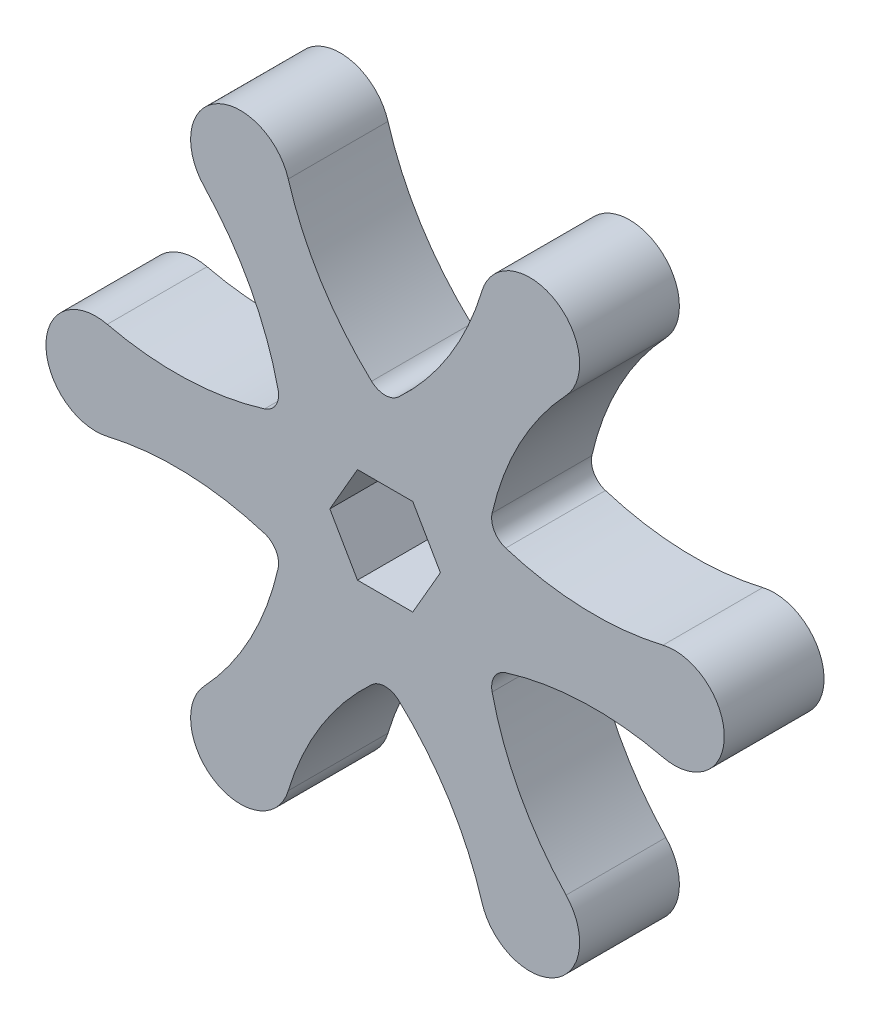
from build123d import *

# Parameters (mm, degrees)
ESQUISSE1_R             = 5
ESQUISSE1_R_2           = 10
BOSS_EXTRU_1_DEPTH      = 10
CONG_1_R                = 2
ENL_V_MAT_EXTRU_1_DEPTH = 1


with BuildPart() as part:
    # Esquisse1 → Boss.-Extru.1 (new body)
    # profile 1 of 19: a face of its own
    with BuildSketch(Plane(origin=(0, 0, 0), x_dir=(0, 1, 0), z_dir=(0, 0, 1))):
        with Locations((0, -29)):
            Circle(ESQUISSE1_R)
    # profile 2 of 19: a face of its own
    with BuildSketch(Plane(origin=(0, 0, 0), x_dir=(0, 1, 0), z_dir=(0, 0, 1))):
        with BuildLine():
            ThreePointArc((5.99413543, -10.382147113), (3.146801004, -10.052477503), (0.281000689, -9.996051151))
            ThreePointArc((0.281000689, -9.996051151), (0, -10), (-0.281000689, -9.996051151))
            ThreePointArc((-0.281000689, -9.996051151), (-3.146801004, -10.052477503), (-5.99413543, -10.382147113))
            ThreePointArc((-5.99413543, -10.382147113), (-4.127637704, -19.033097235), (-4.866476509, -27.852216749))
            ThreePointArc((-4.866476509, -27.852216749), (0, -24), (4.866476509, -27.852216749))
            ThreePointArc((4.866476509, -27.852216749), (4.127637704, -19.033097235), (5.99413543, -10.382147113))
        make_face()
    # profile 3 of 19: a face of its own
    with BuildSketch(Plane(origin=(0, 0, 0), x_dir=(0, 1, 0), z_dir=(0, 0, 1))):
        with Locations((25.11473671, -14.5)):
            Circle(ESQUISSE1_R)
    # profile 4 of 19: a face of its own
    with BuildSketch(Plane(origin=(0, 0, 0), x_dir=(0, 1, 0), z_dir=(0, 0, 1))):
        with BuildLine():
            ThreePointArc((11.98827086, 0), (10.279101391, -2.301029141), (8.797334579, -4.754671841))
            ThreePointArc((8.797334579, -4.754671841), (8.660254038, -5), (8.51633389, -5.24137931))
            ThreePointArc((8.51633389, -5.24137931), (7.132300386, -7.751448362), (5.99413543, -10.382147113))
            ThreePointArc((5.99413543, -10.382147113), (14.419326866, -13.091187726), (21.687489002, -18.140600658))
            ThreePointArc((21.687489002, -18.140600658), (20.784609691, -12), (26.55396551, -9.711616091))
            ThreePointArc((26.55396551, -9.711616091), (18.54696457, -5.941909508), (11.98827086, 0))
        make_face()
    # profile 5 of 19: a face of its own
    with BuildSketch(Plane(origin=(0, 0, 0), x_dir=(0, 1, 0), z_dir=(0, 0, 1))):
        with Locations((-25.11473671, -14.5)):
            Circle(ESQUISSE1_R)
    # profile 6 of 19: a face of its own
    with BuildSketch(Plane(origin=(0, 0, 0), x_dir=(0, 1, 0), z_dir=(0, 0, 1))):
        with BuildLine():
            ThreePointArc((-5.99413543, -10.382147113), (-7.132300386, -7.751448362), (-8.51633389, -5.24137931))
            ThreePointArc((-8.51633389, -5.24137931), (-8.660254038, -5), (-8.797334579, -4.754671841))
            ThreePointArc((-8.797334579, -4.754671841), (-10.279101391, -2.301029141), (-11.98827086, 0))
            ThreePointArc((-11.98827086, 0), (-18.54696457, -5.941909508), (-26.55396551, -9.711616091))
            ThreePointArc((-26.55396551, -9.711616091), (-22.131126816, -10.487759728), (-20.11473671, -14.5))
            ThreePointArc((-20.11473671, -14.5), (-20.524734611, -16.482897055), (-21.687489002, -18.140600658))
            ThreePointArc((-21.687489002, -18.140600658), (-14.419326866, -13.091187726), (-5.99413543, -10.382147113))
        make_face()
    # profile 7 of 19: a face of its own
    with BuildSketch(Plane(origin=(0, 0, 0), x_dir=(0, 1, 0), z_dir=(0, 0, 1))):
        with BuildLine():
            ThreePointArc((-8.797334579, 4.754671841), (-8.660254038, 5), (-8.51633389, 5.24137931))
            ThreePointArc((-8.51633389, 5.24137931), (-7.132300386, 7.751448362), (-5.99413543, 10.382147113))
            ThreePointArc((-5.99413543, 10.382147113), (-14.419326866, 13.091187726), (-21.687489002, 18.140600658))
            ThreePointArc((-21.687489002, 18.140600658), (-20.524734611, 16.482897055), (-20.11473671, 14.5))
            ThreePointArc((-20.11473671, 14.5), (-22.131126816, 10.487759728), (-26.55396551, 9.711616091))
            ThreePointArc((-26.55396551, 9.711616091), (-18.54696457, 5.941909508), (-11.98827086, 0))
            ThreePointArc((-11.98827086, 0), (-10.279101391, 2.301029141), (-8.797334579, 4.754671841))
        make_face()
    # profile 8 of 19: a face of its own
    with BuildSketch(Plane(origin=(0, 0, 0), x_dir=(0, 1, 0), z_dir=(0, 0, 1))):
        with Locations((-25.11473671, 14.5)):
            Circle(ESQUISSE1_R)
    # profile 9 of 19: a face of its own
    with BuildSketch(Plane(origin=(0, 0, 0), x_dir=(0, 1, 0), z_dir=(0, 0, 1))):
        with BuildLine():
            ThreePointArc((-8.797334579, -4.754671841), (-10, 0), (-8.797334579, 4.754671841))
            ThreePointArc((-8.797334579, 4.754671841), (-10.279101391, 2.301029141), (-11.98827086, 0))
            ThreePointArc((-11.98827086, 0), (-10.279101391, -2.301029141), (-8.797334579, -4.754671841))
        make_face()
    # profile 10 of 19: a face of its own
    with BuildSketch(Plane(origin=(0, 0, 0), x_dir=(0, 1, 0), z_dir=(0, 0, 1))):
        with BuildLine():
            ThreePointArc((-5.99413543, -10.382147113), (-3.146801004, -10.052477503), (-0.281000689, -9.996051151))
            ThreePointArc((-0.281000689, -9.996051151), (-5, -8.660254038), (-8.51633389, -5.24137931))
            ThreePointArc((-8.51633389, -5.24137931), (-7.132300386, -7.751448362), (-5.99413543, -10.382147113))
        make_face()
    # profile 11 of 19: a face of its own
    with BuildSketch(Plane(origin=(0, 0, 0), x_dir=(0, 1, 0), z_dir=(0, 0, 1))):
        Circle(ESQUISSE1_R_2)
        Polygon((4.8, 2.771281292), (0, 5.542562584), (-4.8, 2.771281292), (-4.8, -2.771281292), (0, -5.542562584), (4.8, -2.771281292), align=None, mode=Mode.SUBTRACT)
    # profile 12 of 19: a face of its own
    with BuildSketch(Plane(origin=(0, 0, 0), x_dir=(0, 1, 0), z_dir=(0, 0, 1))):
        with BuildLine():
            ThreePointArc((-8.51633389, 5.24137931), (-5, 8.660254038), (-0.281000689, 9.996051151))
            ThreePointArc((-0.281000689, 9.996051151), (-3.146801004, 10.052477503), (-5.99413543, 10.382147113))
            ThreePointArc((-5.99413543, 10.382147113), (-7.132300386, 7.751448362), (-8.51633389, 5.24137931))
        make_face()
    # profile 13 of 19: a face of its own
    with BuildSketch(Plane(origin=(0, 0, 0), x_dir=(0, 1, 0), z_dir=(0, 0, 1))):
        with BuildLine():
            ThreePointArc((-0.281000689, 9.996051151), (0, 10), (0.281000689, 9.996051151))
            ThreePointArc((0.281000689, 9.996051151), (3.146801004, 10.052477503), (5.99413543, 10.382147113))
            ThreePointArc((5.99413543, 10.382147113), (4.127637704, 19.033097235), (4.866476509, 27.852216749))
            ThreePointArc((4.866476509, 27.852216749), (0, 24), (-4.866476509, 27.852216749))
            ThreePointArc((-4.866476509, 27.852216749), (-4.127637704, 19.033097235), (-5.99413543, 10.382147113))
            ThreePointArc((-5.99413543, 10.382147113), (-3.146801004, 10.052477503), (-0.281000689, 9.996051151))
        make_face()
    # profile 14 of 19: a face of its own
    with BuildSketch(Plane(origin=(0, 0, 0), x_dir=(0, 1, 0), z_dir=(0, 0, 1))):
        with BuildLine():
            ThreePointArc((8.51633389, 5.24137931), (8.660254038, 5), (8.797334579, 4.754671841))
            ThreePointArc((8.797334579, 4.754671841), (10.279101391, 2.301029141), (11.98827086, 0))
            ThreePointArc((11.98827086, 0), (18.54696457, 5.941909508), (26.55396551, 9.711616091))
            ThreePointArc((26.55396551, 9.711616091), (20.784609691, 12), (21.687489002, 18.140600658))
            ThreePointArc((21.687489002, 18.140600658), (14.419326866, 13.091187726), (5.99413543, 10.382147113))
            ThreePointArc((5.99413543, 10.382147113), (7.132300386, 7.751448362), (8.51633389, 5.24137931))
        make_face()
    # profile 15 of 19: a face of its own
    with BuildSketch(Plane(origin=(0, 0, 0), x_dir=(0, 1, 0), z_dir=(0, 0, 1))):
        with BuildLine():
            ThreePointArc((0.281000689, 9.996051151), (5, 8.660254038), (8.51633389, 5.24137931))
            ThreePointArc((8.51633389, 5.24137931), (7.132300386, 7.751448362), (5.99413543, 10.382147113))
            ThreePointArc((5.99413543, 10.382147113), (3.146801004, 10.052477503), (0.281000689, 9.996051151))
        make_face()
    # profile 16 of 19: a face of its own
    with BuildSketch(Plane(origin=(0, 0, 0), x_dir=(0, 1, 0), z_dir=(0, 0, 1))):
        with BuildLine():
            ThreePointArc((8.797334579, 4.754671841), (9.694672397, 2.452208618), (10, 0))
            ThreePointArc((10, 0), (9.694672397, -2.452208618), (8.797334579, -4.754671841))
            ThreePointArc((8.797334579, -4.754671841), (10.279101391, -2.301029141), (11.98827086, 0))
            ThreePointArc((11.98827086, 0), (10.279101391, 2.301029141), (8.797334579, 4.754671841))
        make_face()
    # profile 17 of 19: a face of its own
    with BuildSketch(Plane(origin=(0, 0, 0), x_dir=(0, 1, 0), z_dir=(0, 0, 1))):
        with BuildLine():
            ThreePointArc((5.99413543, -10.382147113), (7.132300386, -7.751448362), (8.51633389, -5.24137931))
            ThreePointArc((8.51633389, -5.24137931), (5, -8.660254038), (0.281000689, -9.996051151))
            ThreePointArc((0.281000689, -9.996051151), (3.146801004, -10.052477503), (5.99413543, -10.382147113))
        make_face()
    # profile 18 of 19: a face of its own
    with BuildSketch(Plane(origin=(0, 0, 0), x_dir=(0, 1, 0), z_dir=(0, 0, 1))):
        with Locations((25.11473671, 14.5)):
            Circle(ESQUISSE1_R)
    # profile 19 of 19: a face of its own
    with BuildSketch(Plane(origin=(0, 0, 0), x_dir=(0, 1, 0), z_dir=(0, 0, 1))):
        with Locations((0, 29)):
            Circle(ESQUISSE1_R)
    extrude(amount=BOSS_EXTRU_1_DEPTH)

    # Congé1
    cong_1_edges = [part.edges().sort_by_distance(p)[0] for p in [
        (10.382147113, 5.99413543, 5),
        (10.382147113, -5.99413543, 5),
        (0, -11.98827086, 5),
        (-10.382147113, -5.99413543, 5),
        (-10.382147113, 5.99413543, 5),
        (0, 11.98827086, 5),
    ]]
    fillet(cong_1_edges, radius=CONG_1_R)

    # Esquisse2 → Enlèv. mat.-Extru.1 (cut)
    with BuildSketch(Plane(origin=(0, 0, 0), x_dir=(1, 0, 0), z_dir=(0, 0, -1))):
        with BuildLine():
            Line((0, 9.5), (-2, 8.261355821))
            Line((-2, 8.261355821), (0, 7.5))
            ThreePointArc((0, 7.5), (5.303300859, -5.303300859), (-7.5, 0))
            Line((-7.5, 0), (-8.261355821, -2))
            Line((-8.261355821, -2), (-9.5, 0))
            ThreePointArc((-9.5, 0), (6.717514421, -6.717514421), (0, 9.5))
        make_face()
        Polygon((-7.471570722, 6.176220416), (-7.471570722, 7.394169134), (-6.638237388, 7.394169134), (-6.638237388, 6.176220416), (-5.356186106, 6.176220416), (-5.356186106, 5.342887082), (-6.638237388, 5.342887082), (-6.638237388, 4.124938365), (-7.471570722, 4.124938365), (-7.471570722, 5.342887082), (-8.753622004, 5.342887082), (-8.753622004, 6.176220416), align=None)
    extrude(amount=-ENL_V_MAT_EXTRU_1_DEPTH, mode=Mode.SUBTRACT)


solid = part.part
